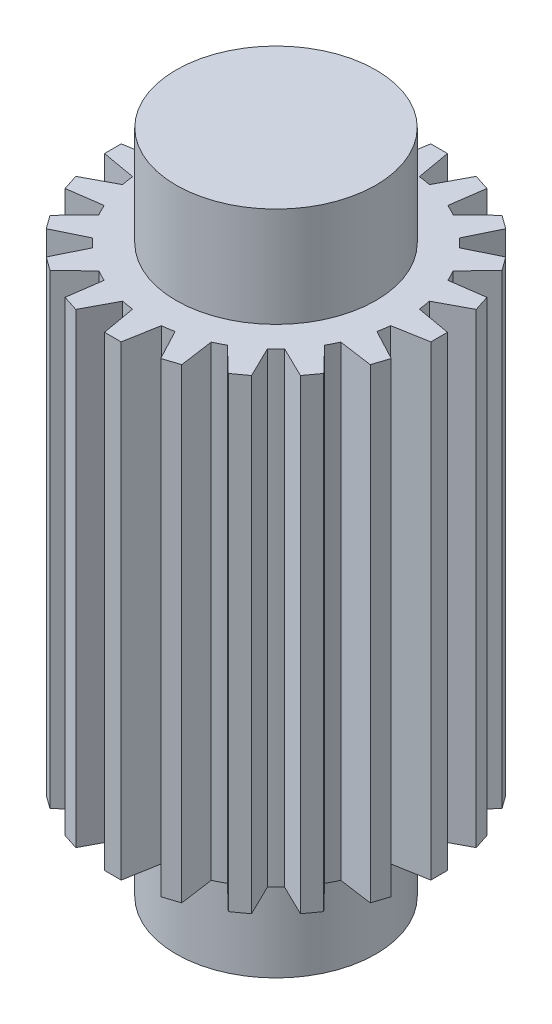
from build123d import *

# Parameters (mm, degrees)
SKETCH1_R                = 3.9
BOSS_EXTRUDE1_DEPTH      = 14
BOSS_EXTRUDE2_DEPTH      = 14
CIRPATTERN1_COUNT        = 20
BOSS_EXTRUDE3_DEPTH      = 3
BOSS_EXTRUDE3_DEPTH_BACK = 17
SKETCH5_R                = 3


with BuildPart() as part:
    # Sketch1 → Boss-Extrude1 (new body)
    with BuildSketch(Plane(origin=(0, 0, 0), x_dir=(1, 0, 0), z_dir=(0, 1, 0))):
        with Locations(Location((0, 0, 0), (0, 0, 270))):
            Circle(SKETCH1_R)
    extrude(amount=BOSS_EXTRUDE1_DEPTH)

    # Sketch2 → Boss-Extrude2 (add)
    with BuildSketch(Plane(origin=(0, 14, 0), x_dir=(1, 0, 0), z_dir=(0, 1, 0))):
        Polygon((-0.25, 4.9), (0.25, 4.9), (0.64014281, 2.687390175), (-0.64014281, 2.687390175), align=None)
    boss_extrude2 = extrude(amount=-BOSS_EXTRUDE2_DEPTH)

    # CirPattern1: Boss-Extrude2 ×20 about axis
    cirpattern1_axis = Axis((0, 0, 0), (0, 1, 0))
    for i in range(1, CIRPATTERN1_COUNT):
        add(boss_extrude2.rotate(cirpattern1_axis, i * 360 / CIRPATTERN1_COUNT))

    # Sketch5 → Boss-Extrude3 (add, two sides: drawn at the far end of the back side and taken through both)
    with BuildSketch(Plane(origin=(0, 14, 0), x_dir=(1, 0, 0), z_dir=(0, 1, 0)).offset(-BOSS_EXTRUDE3_DEPTH_BACK)):
        with Locations(Location((0, 0, 0), (0, 0, 270))):
            Circle(SKETCH5_R)
    extrude(amount=BOSS_EXTRUDE3_DEPTH + BOSS_EXTRUDE3_DEPTH_BACK)


solid = part.part
